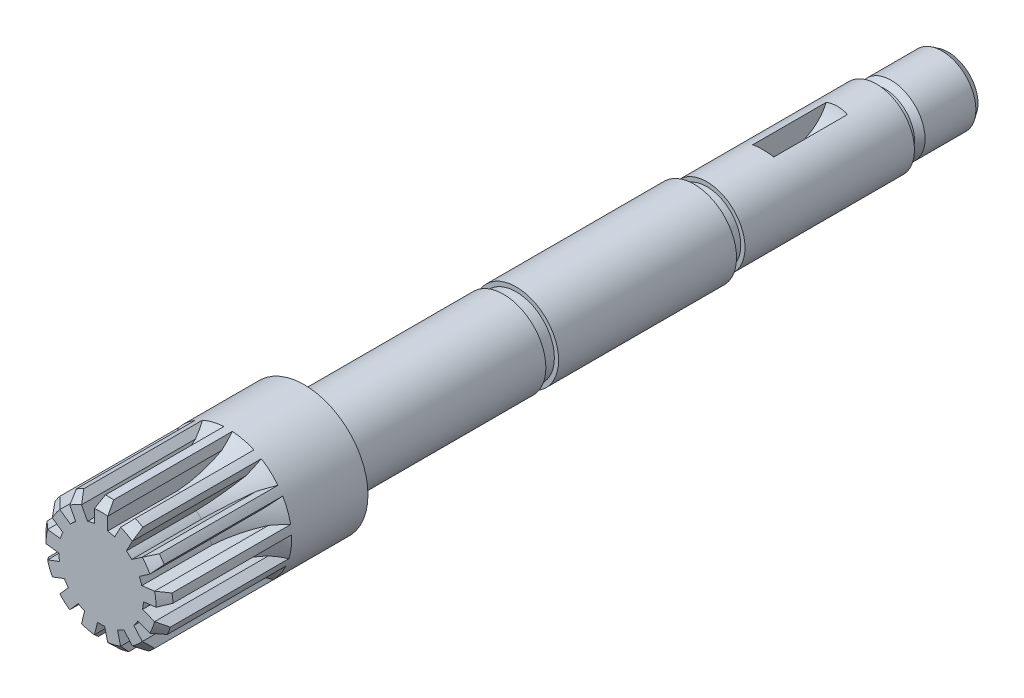
from build123d import *

# Parameters (mm, degrees)
EXTRUDE_1_REACH                      = 203.122
CHAMFER_1_SIZE                       = 2
PATTERN_CIRCULAR_1_COUNT             = 13
CHAMFER_1_OF_PATTERN_CIRCULAR_1_SIZE = 2
CUT_EXTRUDE_1_DEPTH                  = 2.5


with BuildPart() as part:
    # Эскиз1 → Повернуть1 (revolve)
    with BuildSketch(Plane(origin=(0, 0, 0), x_dir=(0, 0, -1), z_dir=(1, 0, 0)), mode=Mode.PRIVATE) as revolve_1_sk:
        with BuildLine():
            Line((105, 0), (105, 7))
            Line((105, 7), (103.5, 8))
            Line((103.5, 8), (91.5, 8))
            Line((91.5, 8), (90, 7))
            Line((90, 7), (88, 7))
            Line((88, 7), (88, 9))
            Line((88, 9), (48, 9))
            Line((48, 9), (48, 8))
            Line((48, 8), (45, 8))
            Line((45, 8), (45, 10))
            Line((45, 10), (3, 10))
            Line((3, 10), (3, 9))
            Line((3, 9), (0, 9))
            Line((0, 9), (0, 10))
            Line((0, 10), (-46, 10))
            Line((-46, 10), (-46, 13))
            ThreePointArc((-46, 13), (-46.292893219, 13.707106781), (-47, 14))
            Line((-47, 14), (-47, 15))
            Line((-47, 15), (-65, 15))
            ThreePointArc((-65, 15), (-71.391794452, 11.504418877), (-78.519967259, 10))
            Line((-78.519967259, 10), (-95, 10))
            Line((-95, 10), (-95, 0))
            Line((-95, 0), (105, 0))
        make_face()
    revolve(revolve_1_sk.sketch.rotate(Axis((0, 0, 95), (0, 0, -1)), 90), axis=Axis((0, 0, 95), (0, 0, -1)))

    # Эскиз2 → Бобышка-Вытянуть1 (add, up to next)
    with BuildSketch(Plane.XY.offset(95), mode=Mode.PRIVATE) as extrude_1_sk1:
        with BuildLine():
            Line((1.566976519, 12.905215403), (0.993843905, 14.967039597))
            ThreePointArc((0.993843905, 14.967039597), (0, 15), (-0.993843905, 14.967039597))
            Line((-0.993843905, 14.967039597), (-1.566976519, 12.905215403))
            Line((-1.566976519, 12.905215403), (-1.566976519, 9.876466199))
            ThreePointArc((-1.566976519, 9.876466199), (0, 10), (1.566976519, 9.876466199))
            Line((1.566976519, 9.876466199), (1.566976519, 12.905215403))
        make_face()
    extrude_1_tool1 = extrude(extrude_1_sk1.sketch, amount=-EXTRUDE_1_REACH, mode=Mode.PRIVATE) - part.part
    extrude_1 = extrude_1_tool1.solids().sort_by_distance((0, 12.322911, 95))[0]
    add(extrude_1)

    # Фаска1
    chamfer_1_edges = [part.edges().sort_by_distance(p)[0] for p in [
        (0, 15, 95),
    ]]
    chamfer(chamfer_1_edges, length=CHAMFER_1_SIZE)

    # Круговой массив1: Бобышка-Вытянуть1 ×13 about axis
    pattern_circular_1_axis = Axis((0, 0, 0), (0, 0, 1))
    for i in range(1, PATTERN_CIRCULAR_1_COUNT):
        add(extrude_1.rotate(pattern_circular_1_axis, i * 360 / PATTERN_CIRCULAR_1_COUNT))

    # Фаска1 of Круговой массив1
    chamfer_1_of_pattern_circular_1_edges = [part.edges().sort_by_distance(p)[0] for p in [
        (-6.970847581, 13.281840385, 95),
        (-12.344757988, 8.520971201, 95),
        (-14.890633111, 1.808050204, 95),
        (-14.02524364, -5.319073306, 95),
        (-9.946839874, -11.227661223, 95),
        (-3.589734964, -14.564127261, 95),
        (3.589734964, -14.564127261, 95),
        (9.946839874, -11.227661223, 95),
        (14.02524364, -5.319073306, 95),
        (14.890633111, 1.808050204, 95),
        (12.344757988, 8.520971201, 95),
        (6.970847581, 13.281840385, 95),
    ]]
    chamfer(chamfer_1_of_pattern_circular_1_edges, length=CHAMFER_1_OF_PATTERN_CIRCULAR_1_SIZE)

    # Эскиз3 → Вырез-Вытянуть1 (cut, symmetric)
    with BuildSketch(Plane(origin=(0, 0, 0), x_dir=(0, 0, -1), z_dir=(1, 0, 0))):
        with BuildLine():
            Line((60.712912189, 10.500005854), (79.287087811, 10.500005854))
            ThreePointArc((79.287087811, 10.500005854), (70, 3.000005854), (60.712912189, 10.500005854))
        make_face()
    extrude(amount=CUT_EXTRUDE_1_DEPTH, both=True, mode=Mode.SUBTRACT)


solid = part.part
